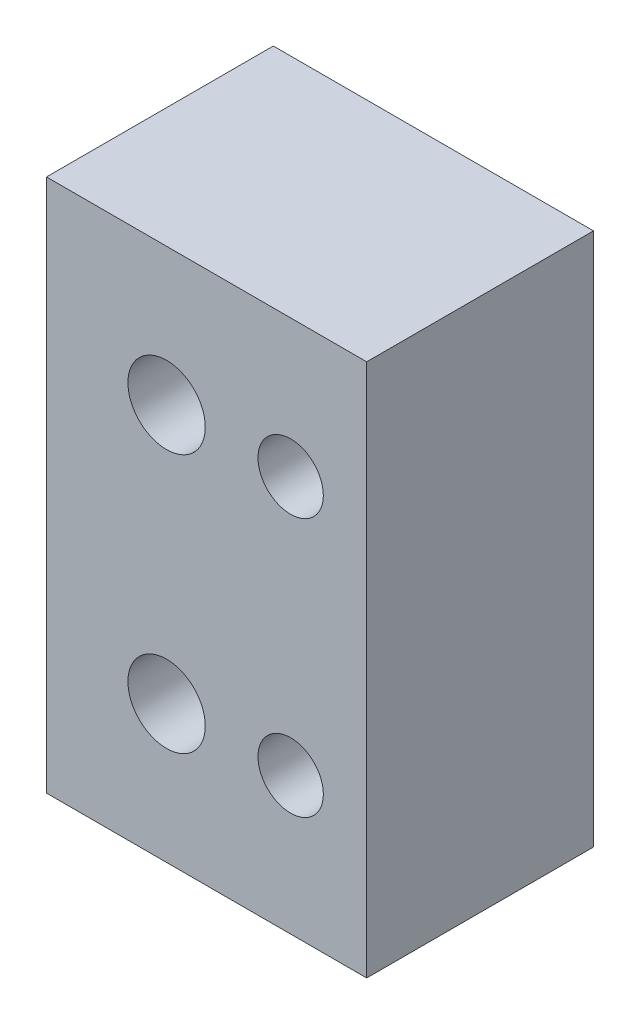
from build123d import *

# Parameters (mm, degrees)
SKETCH_3_W      = 12
SKETCH_3_H      = 20
SKETCH_3_R      = 1.45
SKETCH_3_R_2    = 1.225
EXTRUDE_1_DEPTH = 8.5


with BuildPart() as part:
    # 草图3 → 凸台-拉伸1 (new body)
    with BuildSketch(Plane.XY):
        with Locations((6, 10)):
            Rectangle(SKETCH_3_W, SKETCH_3_H)
        with Locations((4.5, 14.85)):
            Circle(SKETCH_3_R, mode=Mode.SUBTRACT)
        with Locations((4.5, 5.15)):
            Circle(SKETCH_3_R, mode=Mode.SUBTRACT)
        with Locations((9.15, 14.85)):
            Circle(SKETCH_3_R_2, mode=Mode.SUBTRACT)
        with Locations((9.15, 5.15)):
            Circle(SKETCH_3_R_2, mode=Mode.SUBTRACT)
    extrude(amount=EXTRUDE_1_DEPTH)


solid = part.part
